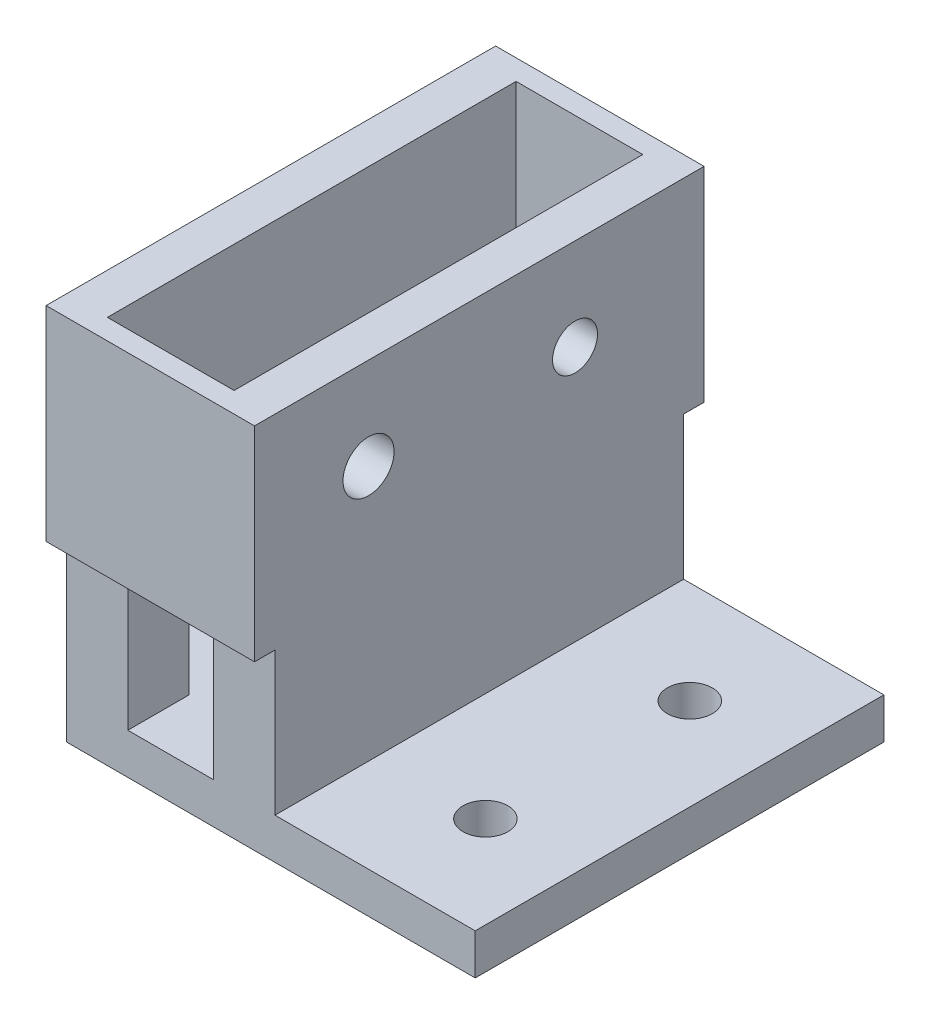
from build123d import *

# Parameters (mm, degrees)
BOSS_EXTRUDE1_DEPTH  = 20
SKETCH2_W            = 14
SKETCH2_H            = 4
CUT_EXTRUDE1_DEPTH   = 3
SKETCH4_R            = 1.1
CUT_EXTRUDE2_DEPTH   = 20
SKETCH3_R            = 1.25
SKETCH3_R_2          = 1.1
CUT_EXTRUDE3_DEPTH   = 2
SKETCH9_W            = 10.2
SKETCH9_H            = 1
BOSS_EXTRUDE11_DEPTH = 10


with BuildPart() as part:
    # Sketch1 → Boss-Extrude1 (new body)
    with BuildSketch(Plane.XY):
        Polygon((0, 11), (0, -8), (20, -8), (20, -6), (10.2, -6), (10.2, 11), (8.2, 11), (8.2, 2), (7.2, 2), (7.2, -6), (3, -6), (3, 2), (2, 2), (2, 11), align=None)
    extrude(amount=BOSS_EXTRUDE1_DEPTH)

    # Sketch2 → Cut-Extrude1 (cut)
    with BuildSketch(Plane.ZY):
        with Locations((10, -4)):
            Rectangle(SKETCH2_W, SKETCH2_H)
    extrude(amount=-CUT_EXTRUDE1_DEPTH, mode=Mode.SUBTRACT)

    # Sketch4 → Cut-Extrude2 (cut)
    with BuildSketch(Plane(origin=(0, -6, 0), x_dir=(1, 0, 0), z_dir=(0, 1, 0))):
        with Locations(Location((15.5, -5, 0), (0, 0, 270))):
            Circle(SKETCH4_R)
        with Locations(Location((15.5, -15, 0), (0, 0, 270))):
            Circle(SKETCH4_R)
    extrude(amount=-CUT_EXTRUDE2_DEPTH, mode=Mode.SUBTRACT)

    # Sketch3 → Cut-Extrude3 (cut)
    with BuildSketch(Plane(origin=(10.2, 0, 0), x_dir=(0, 0, -1), z_dir=(1, 0, 0))):
        with Locations((-15.421154519, 6.5)):
            Circle(SKETCH3_R)
        with Locations((-5.315777108, 6.5)):
            Circle(SKETCH3_R_2)
    extrude(amount=-CUT_EXTRUDE3_DEPTH, mode=Mode.SUBTRACT)

    # Sketch9 → Boss-Extrude11 (add)
    with BuildSketch(Plane(origin=(0, 11, 0), x_dir=(1, 0, 0), z_dir=(0, 1, 0))):
        with Locations((5.1, 0.5)):
            Rectangle(SKETCH9_W, SKETCH9_H)
        with Locations((5.1, -20.5)):
            Rectangle(SKETCH9_W, SKETCH9_H)
    extrude(amount=-BOSS_EXTRUDE11_DEPTH)


solid = part.part
